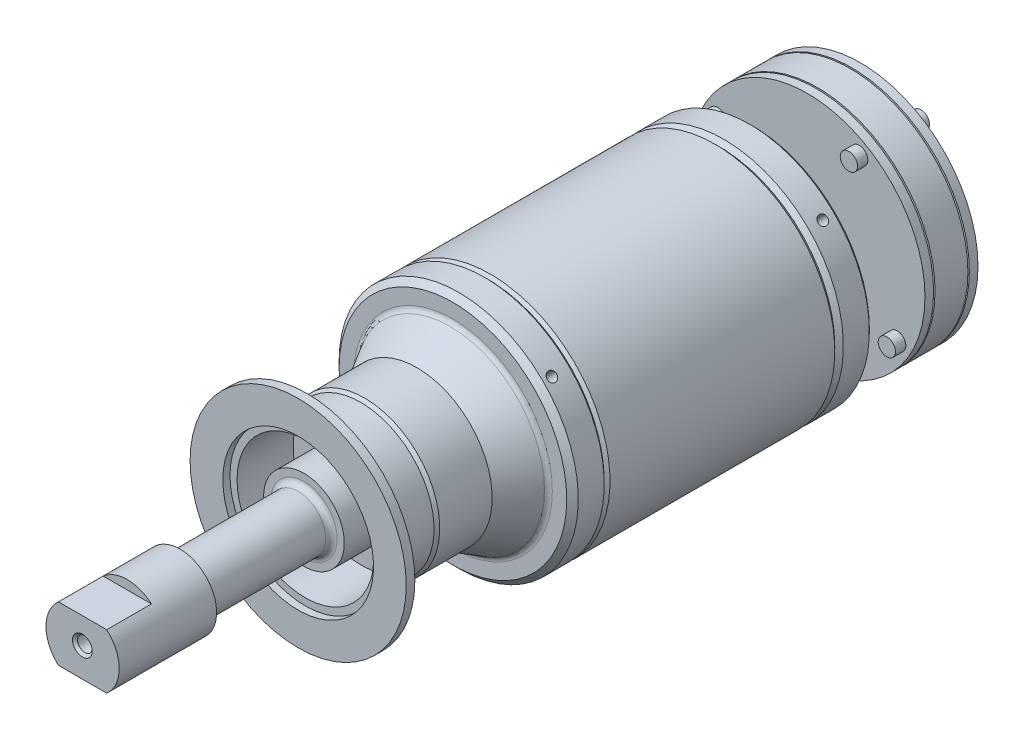
from build123d import *

# Parameters (mm, degrees)
EXTRUDE1_DEPTH                    = 20
FILLET1_R                         = 2
CHAMFER2_SIZE                     = 1
F_1_4_20_TAPPED_HOLE1_D           = 5.1054
F_1_4_20_TAPPED_HOLE1_DEPTH       = 19.05
F_1_4_20_TAPPED_HOLE1_CSINK_D     = 6.858
F_1_4_20_TAPPED_HOLE1_CSINK_ANGLE = 90
F_1_4_20_TAPPED_HOLE1_TIP         = 1.533816902
CIRPATTERN2_COUNT                 = 4
BOSS_EXTRUDE3_START               = -22
SKETCH11_R                        = 3
BOSS_EXTRUDE3_DEPTH               = 25
CIRPATTERN3_COUNT                 = 4


with BuildPart() as part:
    # Sketch1 → Revolve1 (revolve)
    with BuildSketch(Plane(origin=(0, 0, 0), x_dir=(0, 0, -1), z_dir=(1, 0, 0))):
        with BuildLine():
            Line((-96.8, 0), (178.8, 0))
            Line((178.8, 0), (178.8, 4.25))
            Line((178.8, 4.25), (174.1, 4.25))
            Line((174.1, 4.25), (174.1, 6.3))
            Line((174.1, 6.3), (173.1, 6.3))
            Line((173.1, 6.3), (173.1, 40.8))
            Line((173.1, 40.8), (170.1, 40.8))
            Line((170.1, 40.8), (170.1, 37.8))
            Line((170.1, 37.8), (169.6, 37.8))
            Line((169.6, 37.8), (169.6, 40.8))
            Line((169.6, 40.8), (158.2, 40.8))
            Line((158.2, 40.8), (158.2, 37.8))
            Line((158.2, 37.8), (157.7, 37.8))
            Line((157.7, 37.8), (157.7, 40.8))
            Line((157.7, 40.8), (154.7, 40.8))
            Line((154.7, 40.8), (154.7, 6.3))
            Line((154.7, 6.3), (137.7, 6.3))
            Line((137.7, 6.3), (137.7, 7))
            Line((137.7, 7), (135.7, 7))
            Line((135.7, 7), (135.7, 41.5))
            Line((135.7, 41.5), (125.7, 41.5))
            Line((125.7, 41.5), (124.2, 40))
            Line((124.2, 40), (122.7, 41.5))
            Line((122.7, 41.5), (44.7, 41.5))
            Line((44.7, 41.5), (43.7, 40.5))
            Line((43.7, 40.5), (42.7, 41.5))
            Line((42.7, 41.5), (33.7, 41.5))
            Line((33.7, 41.5), (31.7, 39.5))
            Line((31.7, 39.5), (31.7, 34.495478903))
            ThreePointArc((31.7, 34.495478903), (31.432050808, 33.495478903), (30.7, 32.763428096))
            Line((30.7, 32.763428096), (19.2, 26.1239))
            Line((19.2, 26.1239), (1, 26.1239))
            Line((1, 26.1239), (-0.25383158, 25.4))
            Line((-0.25383158, 25.4), (-15.757814772, 25.4))
            Line((-15.757814772, 25.4), (-19, 37.5))
            Line((-19, 37.5), (-22, 37.5))
            Line((-22, 37.5), (-22, 26.15))
            Line((-22, 26.15), (-19.5, 26.15))
            Line((-19.5, 26.15), (-19.5, 23.7109))
            Line((-19.5, 23.7109), (0, 23.7109))
            Line((0, 23.7109), (0, 14))
            Line((0, 14), (-20, 14))
            Line((-20, 14), (-20, 9.525))
            Line((-20, 9.525), (-63, 9.525))
            Line((-63, 9.525), (-63, 12.7))
            Line((-63, 12.7), (-96.8, 12.7))
            Line((-96.8, 12.7), (-96.8, 0))
        make_face()
    revolve(axis=Axis((0, 0, 96.8), (0, 0, 1)))

    # Sketch2 → Extrude1 (cut, symmetric)
    with BuildSketch(Plane(origin=(0, 0, 0), x_dir=(0, 0, -1), z_dir=(1, 0, 0))):
        Polygon((-81.3, 20), (-81.3, 9.55), (-111.3, 9.55), (-111.3, -9.55), (-81.3, -9.55), (-81.3, -20), (-121.3, -20), (-121.3, 20), align=None)
    extrude(amount=EXTRUDE1_DEPTH, both=True, mode=Mode.SUBTRACT)

    # Fillet1
    fillet1_edges = [part.edges().sort_by_distance(p)[0] for p in [
        (0, -9.525, 20),
        (0, -9.525, 63),
    ]]
    fillet(fillet1_edges, radius=FILLET1_R)

    # Chamfer2
    chamfer2_edges = [part.edges().sort_by_distance(p)[0] for p in [
        (0, -41.5, -135.7),
    ]]
    chamfer(chamfer2_edges, length=CHAMFER2_SIZE)

    # 1/4-20 Tapped Hole1
    with Locations(Plane.XY.offset(96.8)):
        with Locations((-0.077364806, 0.560541021)):
            CounterSinkHole(F_1_4_20_TAPPED_HOLE1_D / 2, F_1_4_20_TAPPED_HOLE1_CSINK_D / 2, depth=F_1_4_20_TAPPED_HOLE1_DEPTH, counter_sink_angle=F_1_4_20_TAPPED_HOLE1_CSINK_ANGLE)
            with Locations((0, 0, -(F_1_4_20_TAPPED_HOLE1_DEPTH + F_1_4_20_TAPPED_HOLE1_TIP / 2))):  # 118° drill point
                Cone(0, F_1_4_20_TAPPED_HOLE1_D / 2, F_1_4_20_TAPPED_HOLE1_TIP, mode=Mode.SUBTRACT)

    # Sketch9 → M4x0.7 Tapped Hole1 (revolve, cut)
    with BuildSketch(Plane(origin=(29.344931419, 29.344931419, -130.7), x_dir=(-0.7071067811865489, 0.7071067811865462, 0), z_dir=(0, 0, 1))):
        Polygon((0, 0), (0, 10.991420021), (1.65, 10), (1.65, 0), align=None)
    m4x0_7_tapped_hole1 = revolve(axis=Axis((33.83505948, 33.83505948, -130.7), (-0.7071067811865462, -0.7071067811865489, 0)), mode=Mode.SUBTRACT)

    # Sketch10 → M4x0.7 Tapped Hole2 (revolve, cut)
    with BuildSketch(Plane(origin=(29.344931419, 29.344931419, -36.7), x_dir=(-0.7071067811865488, 0.7071067811865462, 0), z_dir=(0, 0, 1))):
        Polygon((0, 0), (0, 11.091420021), (1.65, 10.1), (1.65, 0), align=None)
    m4x0_7_tapped_hole2 = revolve(axis=Axis((33.83505948, 33.83505948, -36.7), (-0.7071067811865464, -0.7071067811865488, 0)), mode=Mode.SUBTRACT)

    # CirPattern2: M4x0.7 Tapped Hole1, M4x0.7 Tapped Hole2 ×4 about axis
    cirpattern2_axis = Axis((0, 0, -80.9), (0, 0, 1))
    add([m4x0_7_tapped_hole1.rotate(cirpattern2_axis, i * 360 / CIRPATTERN2_COUNT) for i in range(1, CIRPATTERN2_COUNT)], mode=Mode.SUBTRACT)
    add([m4x0_7_tapped_hole2.rotate(cirpattern2_axis, i * 360 / CIRPATTERN2_COUNT) for i in range(1, CIRPATTERN2_COUNT)], mode=Mode.SUBTRACT)

    # Sketch11 → Boss-Extrude3 (add)
    with BuildSketch(Plane(origin=(0, 0, -173.1), x_dir=(-1, 0, 0), z_dir=(0, 0, -1)).offset(BOSS_EXTRUDE3_START)):
        with Locations((-17.9959, 31.169813128)):
            Circle(SKETCH11_R)
    boss_extrude3 = extrude(amount=BOSS_EXTRUDE3_DEPTH)

    # CirPattern3: Boss-Extrude3 ×4 about axis
    cirpattern3_axis = Axis((0, 0, -80.9), (0, 0, 1))
    for i in range(1, CIRPATTERN3_COUNT):
        add(boss_extrude3.rotate(cirpattern3_axis, i * 360 / CIRPATTERN3_COUNT))


solid = part.part
